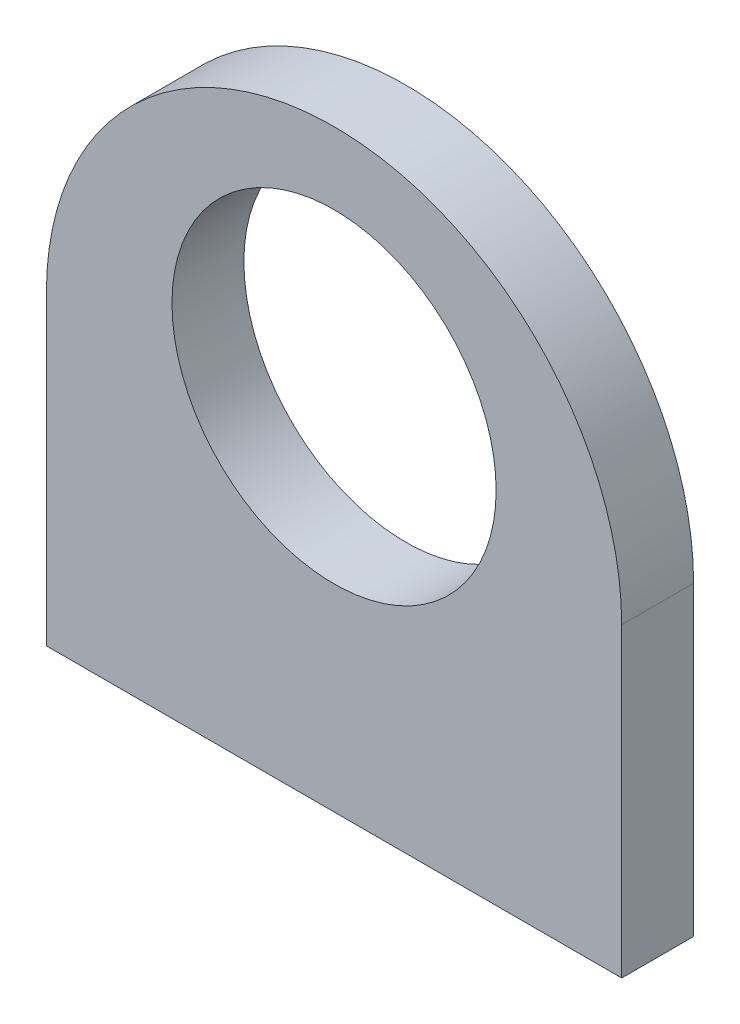
from build123d import *

# Parameters (mm, degrees)
SKETCH1_R           = 14.3129
BOSS_EXTRUDE1_DEPTH = 6.35


with BuildPart() as part:
    # Sketch1 → Boss-Extrude1 (new body)
    with BuildSketch(Plane.XY):
        with BuildLine():
            Line((0, 0), (50.8, 0))
            Line((50.8, 0), (50.8, 27.0129))
            ThreePointArc((50.8, 27.0129), (25.4, 52.4129), (0, 27.0129))
            Line((0, 27.0129), (0, 0))
        make_face()
        with Locations((25.4, 31.75)):
            Circle(SKETCH1_R, mode=Mode.SUBTRACT)
    extrude(amount=BOSS_EXTRUDE1_DEPTH)


solid = part.part
